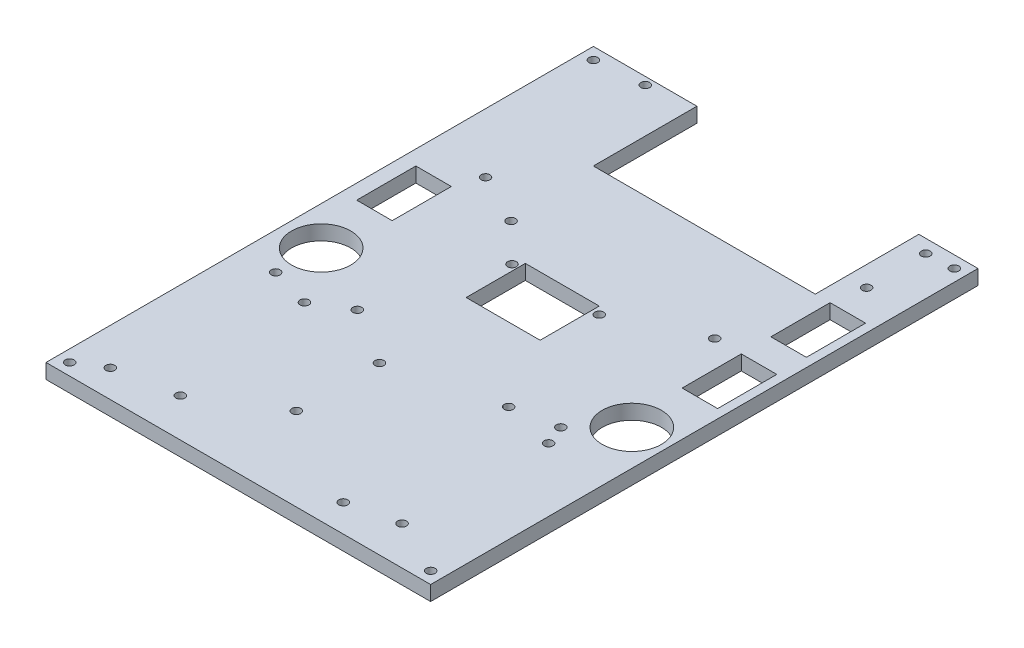
from build123d import *

# Parameters (mm, degrees)
SKETCH1_R           = 1.5
SKETCH1_R_2         = 10
SKETCH1_R_3         = 1.494637137
SKETCH1_W           = 25
SKETCH1_H           = 20
SKETCH1_W_2         = 12
BOSS_EXTRUDE2_DEPTH = 5
SKETCH2_R           = 1.5
CUT_EXTRUDE1_DEPTH  = 100
SKETCH3_R           = 1.5
CUT_EXTRUDE2_DEPTH  = 1220
SKETCH5_R           = 1.5
CUT_EXTRUDE4_DEPTH  = 10


with BuildPart() as part:
    # Sketch1 → Boss-Extrude2 (new body)
    with BuildSketch(Plane(origin=(0, 0, 0), x_dir=(1, 0, 0), z_dir=(0, 1, 0))):
        Polygon((0, 0), (130, 0), (130, 185), (110, 185), (110, 150), (35, 150), (35, 185), (0, 185), align=None)
        with Locations(Location((126, 4, 0), (0, 0, 270))):
            Circle(SKETCH1_R, mode=Mode.SUBTRACT)
        with Locations(Location((4, 4, 0), (0, 0, 90))):
            Circle(SKETCH1_R, mode=Mode.SUBTRACT)
        with Locations(Location((4, 181, 0), (0, 0, 270))):
            Circle(SKETCH1_R, mode=Mode.SUBTRACT)
        with Locations(Location((126, 181, 0), (0, 0, 90))):
            Circle(SKETCH1_R, mode=Mode.SUBTRACT)
        with Locations(Location((13, 80, 0), (0, 0, 270))):
            Circle(SKETCH1_R_2, mode=Mode.SUBTRACT)
        with Locations(Location((118, 80, 0), (0, 0, 270))):
            Circle(SKETCH1_R_2, mode=Mode.SUBTRACT)
        with Locations(Location((79.5, 107.5, 0), (0, 0, 270))):
            Circle(SKETCH1_R, mode=Mode.SUBTRACT)
        with Locations(Location((50, 107.5, 0), (0, 0, 270))):
            Circle(SKETCH1_R, mode=Mode.SUBTRACT)
        with Locations(Location((20.081102583, 128.469773312, 0), (0, 0, 270))):
            Circle(SKETCH1_R_3, mode=Mode.SUBTRACT)
        with Locations(Location((116.797060631, 180.536614994, 0), (0, 0, 270))):
            Circle(SKETCH1_R, mode=Mode.SUBTRACT)
        with Locations(Location((20.081102583, 182.469773312, 0), (0, 0, 270))):
            Circle(SKETCH1_R, mode=Mode.SUBTRACT)
        with Locations(Location((116.797060631, 160.536614994, 0), (0, 0, 270))):
            Circle(SKETCH1_R, mode=Mode.SUBTRACT)
        with Locations((64.5, 100)):
            Rectangle(SKETCH1_W, SKETCH1_H, mode=Mode.SUBTRACT)
        with Locations((11, 110)):
            Rectangle(SKETCH1_W_2, SKETCH1_H, mode=Mode.SUBTRACT)
        with Locations((121, 110)):
            Rectangle(SKETCH1_W_2, SKETCH1_H, mode=Mode.SUBTRACT)
        with Locations((121, 140)):
            Rectangle(SKETCH1_W_2, SKETCH1_H, mode=Mode.SUBTRACT)
    extrude(amount=BOSS_EXTRUDE2_DEPTH)

    # Sketch2 → Cut-Extrude1 (cut)
    with BuildSketch(Plane(origin=(0, 5, 0), x_dir=(1, 0, 0), z_dir=(0, 1, 0))):
        with Locations(Location((12.444428106, 65.171668427, 0), (0, 0, 270))):
            Circle(SKETCH2_R)
        with Locations(Location((91.184428106, 65.171668427, 0), (0, 0, 90))):
            Circle(SKETCH2_R)
        with Locations(Location((91.184428106, 9.291668427, 0), (0, 0, 270))):
            Circle(SKETCH2_R)
        with Locations(Location((12.444428106, 9.291668427, 0), (0, 0, 90))):
            Circle(SKETCH2_R)
    extrude(amount=-CUT_EXTRUDE1_DEPTH, mode=Mode.SUBTRACT)

    # Sketch3 → Cut-Extrude2 (cut)
    with BuildSketch(Plane(origin=(0, 5, 0), x_dir=(1, 0, 0), z_dir=(0, 1, 0))):
        with Locations(Location((108.6, 61.26, 0), (0, 0, 270))):
            Circle(SKETCH3_R)
        with Locations(Location((107.33, 13, 0), (0, 0, 270))):
            Circle(SKETCH3_R)
        with Locations(Location((32.4, 13, 0), (0, 0, 270))):
            Circle(SKETCH3_R)
        with Locations(Location((26.1, 61.26, 0), (0, 0, 270))):
            Circle(SKETCH3_R)
        with Locations(Location((56.53, 56.18, 0), (0, 0, 270))):
            Circle(SKETCH3_R)
        with Locations(Location((56.5, 28.1, 0), (0, 0, 270))):
            Circle(SKETCH3_R)
    extrude(amount=-CUT_EXTRUDE2_DEPTH, mode=Mode.SUBTRACT)

    # Sketch5 → Cut-Extrude4 (cut)
    with BuildSketch(Plane(origin=(0, 5, 0), x_dir=(1, 0, 0), z_dir=(0, 1, 0))):
        with Locations(Location((37.2, 120, 0), (0, 0, 270))):
            Circle(SKETCH5_R)
        with Locations(Location((106, 120, 0), (0, 0, 90))):
            Circle(SKETCH5_R)
        with Locations(Location((106, 68, 0), (0, 0, 270))):
            Circle(SKETCH5_R)
        with Locations(Location((37.2, 68, 0), (0, 0, 90))):
            Circle(SKETCH5_R)
    extrude(amount=-CUT_EXTRUDE4_DEPTH, mode=Mode.SUBTRACT)


solid = part.part
